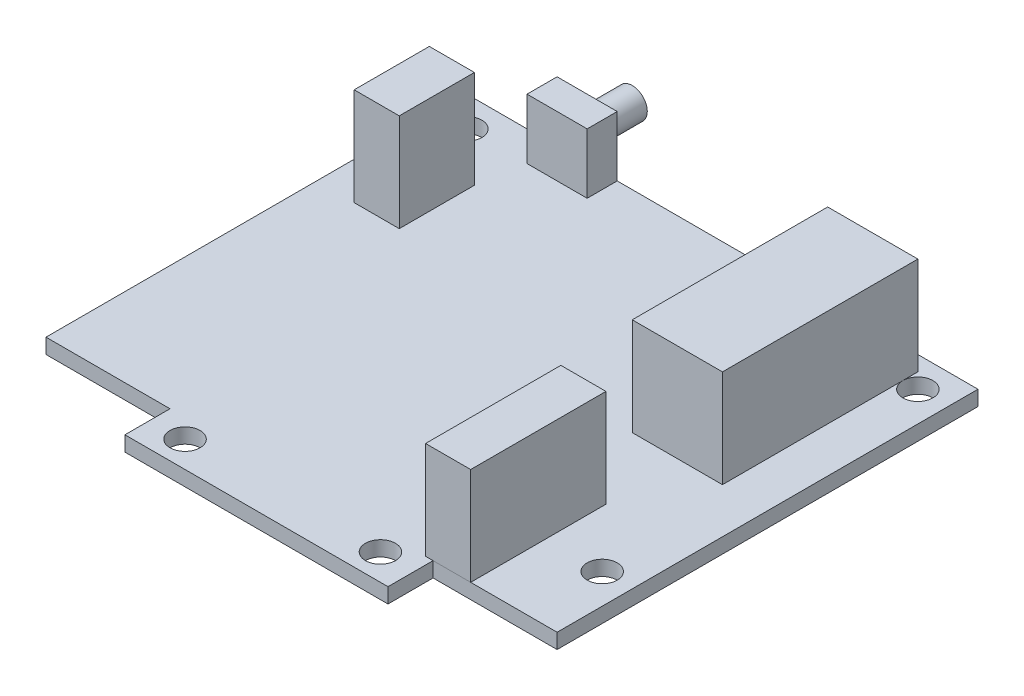
from build123d import *

# Parameters (mm, degrees)
BOSS_EXTRUDE1_DEPTH   = 1.5875
SKETCH2_W             = 4.7625
SKETCH2_H             = 14.2875
BOSS_EXTRUDE2_DEPTH   = 10.31875
SKETCH2_H_2           = 7.9375
BOSS_EXTRUDE2_2_DEPTH = 10.31875
SKETCH2_W_2           = 6.35
SKETCH2_H_3           = 3.175
BOSS_EXTRUDE2_3_DEPTH = 10.31875
SKETCH2_W_3           = 9.525
SKETCH2_H_4           = 20.6375
BOSS_EXTRUDE2_4_DEPTH = 10.31875
SKETCH3_R             = 1.5875
BOSS_EXTRUDE3_DEPTH   = 4.7625
SKETCH4_W             = 6.35
SKETCH4_H             = 3.96875
CUT_EXTRUDE1_DEPTH    = 58.37555317
BOSS_EXTRUDE4_DEPTH   = 7.9375
BOSS_EXTRUDE5_DEPTH   = 6.35
SKETCH7_R             = 1.5875
CUT_EXTRUDE2_DEPTH    = 41.752705048
SKETCH9_W             = 3.175
SKETCH9_H             = 2.38125
BOSS_EXTRUDE6_DEPTH   = 1.5875


with BuildPart() as part:
    # Sketch1 → Boss-Extrude1 (new body)
    with BuildSketch(Plane(origin=(0, 0, 0), x_dir=(1, 0, 0), z_dir=(0, 1, 0))):
        Polygon((13.890625, -22.225), (26.9875, -22.225), (26.9875, 22.225), (-26.9875, 22.225), (-26.9875, -22.225), (-13.890625, -22.225), (-13.890625, -26.9875), (13.890625, -26.9875), align=None)
    extrude(amount=BOSS_EXTRUDE1_DEPTH)

    # Sketch5 → Boss-Extrude4 (add)
    with BuildSketch(Plane.XZ):
        with BuildLine():
            Line((8.73125, -20.6375), (-8.73125, -20.6375))
            Line((-8.73125, -20.6375), (-8.73125, -13.890625))
            Line((-8.73125, -13.890625), (-10.31875, -13.890625))
            ThreePointArc((-10.31875, -13.890625), (-12.303125, -11.90625), (-10.31875, -9.921875))
            Line((-10.31875, -9.921875), (-8.73125, -9.921875))
            Line((-8.73125, -9.921875), (-8.73125, -3.175))
            Line((-8.73125, -3.175), (8.73125, -3.175))
            Line((8.73125, -3.175), (8.73125, -9.921875))
            Line((8.73125, -9.921875), (10.31875, -9.921875))
            ThreePointArc((10.31875, -9.921875), (12.303125, -11.90625), (10.31875, -13.890625))
            Line((10.31875, -13.890625), (8.73125, -13.890625))
            Line((8.73125, -13.890625), (8.73125, -20.6375))
        make_face()
    extrude(amount=BOSS_EXTRUDE4_DEPTH)

    # Sketch6 → Boss-Extrude5 (add)
    with BuildSketch(Plane.XZ.offset(7.9375)):
        with BuildLine():
            Line((1.190625, -20.6375), (-1.190625, -20.6375))
            Line((-1.190625, -20.6375), (-1.190625, -19.753945099))
            ThreePointArc((-1.190625, -19.753945099), (0, -3.96875), (1.190625, -19.753945099))
            Line((1.190625, -19.753945099), (1.190625, -20.6375))
        make_face()
    extrude(amount=BOSS_EXTRUDE5_DEPTH)

    # Sketch7 → Cut-Extrude2 (cut, through all)
    with BuildSketch(Plane.XZ):
        with Locations(Location((23.8125, -19.05, 0), (0, 0, 270))):
            Circle(SKETCH7_R)
        with Locations(Location((-23.8125, -19.05, 0), (0, 0, 270))):
            Circle(SKETCH7_R)
        with Locations(Location((-10.31875, 24.209375, 0), (0, 0, 270))):
            Circle(SKETCH7_R)
        with Locations(Location((10.31875, 24.209375, 0), (0, 0, 270))):
            Circle(SKETCH7_R)
        with Locations(Location((23.8125, 14.2875, 0), (0, 0, 270))):
            Circle(SKETCH7_R)
    extrude(amount=-CUT_EXTRUDE2_DEPTH, mode=Mode.SUBTRACT)

    # Sketch9 → Boss-Extrude6 (add)
    with BuildSketch(Plane.XZ):
        with Locations((0, 23.415625)):
            Rectangle(SKETCH9_W, SKETCH9_H)
    extrude(amount=BOSS_EXTRUDE6_DEPTH)


with BuildPart() as body_2:
    # Sketch2 → Boss-Extrude2 (new body)
    with BuildSketch(Plane(origin=(0, 1.5875, 0), x_dir=(1, 0, 0), z_dir=(0, 1, 0))):
        with Locations((15.478125, -15.08125)):
            Rectangle(SKETCH2_W, SKETCH2_H)
    extrude(amount=BOSS_EXTRUDE2_DEPTH)


with BuildPart() as body_3:
    # Sketch2 → Boss-Extrude2 2 (new body)
    with BuildSketch(Plane(origin=(0, 1.5875, 0), x_dir=(1, 0, 0), z_dir=(0, 1, 0))):
        with Locations((-20.6375, 10.31875)):
            Rectangle(SKETCH2_W, SKETCH2_H_2)
    extrude(amount=BOSS_EXTRUDE2_2_DEPTH)


with BuildPart() as body_4:
    # Sketch2 → Boss-Extrude2 3 (new body)
    with BuildSketch(Plane(origin=(0, 1.5875, 0), x_dir=(1, 0, 0), z_dir=(0, 1, 0))):
        with Locations((-14.2875, 20.6375)):
            Rectangle(SKETCH2_W_2, SKETCH2_H_3)
    extrude(amount=BOSS_EXTRUDE2_3_DEPTH)

    # Sketch4 → Cut-Extrude1 (cut, through all)
    with BuildSketch(Plane(origin=(0, 0, -22.225), x_dir=(-1, 0, 0), z_dir=(0, 0, -1))):
        with Locations((14.2875, 9.921875)):
            Rectangle(SKETCH4_W, SKETCH4_H)
    extrude(amount=-CUT_EXTRUDE1_DEPTH, mode=Mode.SUBTRACT)


with BuildPart() as body_5:
    # Sketch2 → Boss-Extrude2 4 (new body)
    with BuildSketch(Plane(origin=(0, 1.5875, 0), x_dir=(1, 0, 0), z_dir=(0, 1, 0))):
        with Locations((17.4625, 10.31875)):
            Rectangle(SKETCH2_W_3, SKETCH2_H_4)
    extrude(amount=BOSS_EXTRUDE2_4_DEPTH)


with BuildPart() as body_6:
    # Sketch3 → Boss-Extrude3 (new body)
    with BuildSketch(Plane(origin=(0, 0, -22.225), x_dir=(-1, 0, 0), z_dir=(0, 0, -1))):
        with Locations(Location((14.2875, 4.7625, 0), (0, 0, 180))):
            Circle(SKETCH3_R)
    extrude(amount=BOSS_EXTRUDE3_DEPTH)


solid = Compound([part.part, body_2.part, body_3.part, body_4.part, body_5.part, body_6.part])
